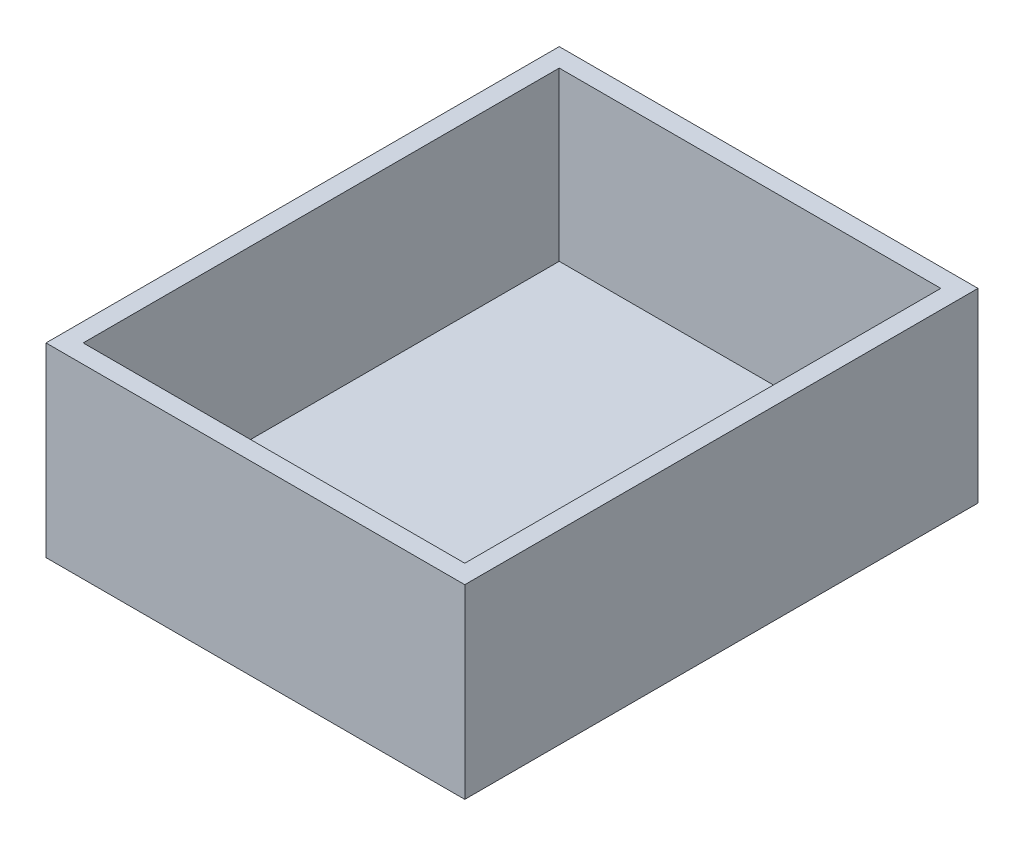
from build123d import *

# Parameters (mm, degrees)
SKETCH1_W           = 101.6
SKETCH1_H           = 127
BOSS_EXTRUDE1_DEPTH = 5
SKETCH4_W           = 102.6
SKETCH4_H           = 128
BOSS_EXTRUDE3_DEPTH = 5
SKETCH5_W           = 112.6
SKETCH5_H           = 138
SKETCH5_W_2         = 102.6
SKETCH5_H_2         = 128
BOSS_EXTRUDE4_DEPTH = 50


with BuildPart() as part:
    # Sketch1 → Boss-Extrude1 (new body)
    with BuildSketch(Plane(origin=(0, 0, 0), x_dir=(1, 0, 0), z_dir=(0, 1, 0))):
        with Locations((9.420607765, 19.952255333)):
            Rectangle(SKETCH1_W, SKETCH1_H)
    extrude(amount=BOSS_EXTRUDE1_DEPTH)

    # Sketch4 → Boss-Extrude3 (add)
    with BuildSketch(Plane(origin=(0, 5, 0), x_dir=(1, 0, 0), z_dir=(0, 1, 0))):
        with Locations((9.420607765, 19.952255333)):
            Rectangle(SKETCH4_W, SKETCH4_H)
    extrude(amount=-BOSS_EXTRUDE3_DEPTH)

    # Sketch5 → Boss-Extrude4 (add)
    with BuildSketch(Plane.XZ):
        with Locations((9.420607765, -19.952255333)):
            Rectangle(SKETCH5_W, SKETCH5_H)
        with Locations((9.420607765, -19.952255333)):
            Rectangle(SKETCH5_W_2, SKETCH5_H_2, mode=Mode.SUBTRACT)
    extrude(amount=-BOSS_EXTRUDE4_DEPTH)


solid = part.part
